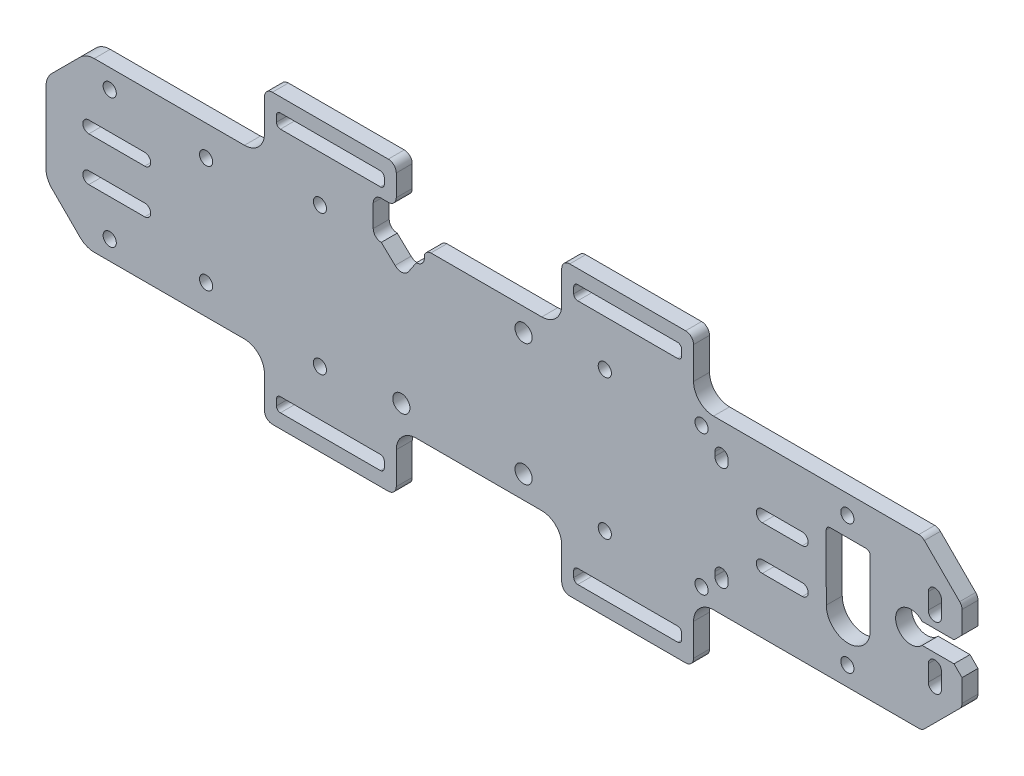
from build123d import *

# Parameters (mm, degrees)
SKETCH_1_R           = 1.65
EXTRUDE_1_DEPTH      = 4
EXTRUDE_3_DEPTH      = 4
SKETCH_31_R          = 2.15
SKETCH_31_R_2        = 1.65
CUT_EXTRUDE_13_DEPTH = 113.95479314
CUT_EXTRUDE_6_DEPTH  = 4
SKETCH_24_R          = 1.65
CUT_EXTRUDE_10_DEPTH = 4
EXTRUDE_4_DEPTH      = 4
XT90_R               = 1.6
CUT_EXTRUDE_12_DEPTH = 148.442447393
FILLET_1_R           = 5
CUT_EXTRUDE_14_DEPTH = 148.442447393
CUT_EXTRUDE_11_DEPTH = 148.442447393
CUT_EXTRUDE_15_DEPTH = 134.20388618
CUT_EXTRUDE_16_DEPTH = 134.20388618


with BuildPart() as part:
    # Эскиз1 → Бобышка-Вытянуть1 (new body)
    with BuildSketch(Plane.XY):
        Polygon((104, -28.895162528), (104, 13.104837472), (-88, 13.104837472), (-98, 3.104837472), (-98, -18.895162528), (-88, -28.895162528), align=None)
        with Locations((-87.65, -24.095162528)):
            Circle(SKETCH_1_R, mode=Mode.SUBTRACT)
        with Locations((-87.65, 8.304837472)):
            Circle(SKETCH_1_R, mode=Mode.SUBTRACT)
    extrude(amount=EXTRUDE_1_DEPTH)

    # Эскиз7 → Бобышка-Вытянуть3 (add)
    # profile 1 of 4: a face of its own
    with BuildSketch(Plane(origin=(0, 0, 0), x_dir=(-1, 0, 0), z_dir=(0, 0, -1))):
        with BuildLine():
            Line((-56.5, 28.104837472), (-27.5, 28.104837472))
            ThreePointArc((-27.5, 28.104837472), (-26.085786438, 27.519051034), (-25.5, 26.104837472))
            Line((-25.5, 26.104837472), (-25.5, 18.104837472))
            ThreePointArc((-25.5, 18.104837472), (-24.035533906, 14.569303566), (-20.5, 13.104837472))
            Line((-20.5, 13.104837472), (-25.5, 13.104837472))
            Line((-25.5, 13.104837472), (-58.5, 13.104837472))
            Line((-58.5, 13.104837472), (-63.5, 13.104837472))
            ThreePointArc((-63.5, 13.104837472), (-59.964466094, 14.569303566), (-58.5, 18.104837472))
            Line((-58.5, 18.104837472), (-58.5, 26.104837472))
            ThreePointArc((-58.5, 26.104837472), (-57.914213562, 27.519051034), (-56.5, 28.104837472))
        make_face()
        with BuildLine():
            Line((-54.5, 24.604837472), (-29.5, 24.604837472))
            ThreePointArc((-29.5, 24.604837472), (-28.792893219, 24.311944253), (-28.5, 23.604837472))
            Line((-28.5, 23.604837472), (-28.5, 22.104837472))
            ThreePointArc((-28.5, 22.104837472), (-28.792893219, 21.397730691), (-29.5, 21.104837472))
            Line((-29.5, 21.104837472), (-54.5, 21.104837472))
            ThreePointArc((-54.5, 21.104837472), (-55.207106781, 21.397730691), (-55.5, 22.104837472))
            Line((-55.5, 22.104837472), (-55.5, 23.604837472))
            ThreePointArc((-55.5, 23.604837472), (-55.207106781, 24.311944253), (-54.5, 24.604837472))
        make_face(mode=Mode.SUBTRACT)
    # profile 2 of 4: a face of its own
    with BuildSketch(Plane(origin=(0, 0, 0), x_dir=(-1, 0, 0), z_dir=(0, 0, -1))):
        with BuildLine():
            Line((-58.5, -41.895162528), (-58.5, -33.895162528))
            ThreePointArc((-58.5, -33.895162528), (-59.964466094, -30.359628622), (-63.5, -28.895162528))
            Line((-63.5, -28.895162528), (-58.5, -28.895162528))
            Line((-58.5, -28.895162528), (-25.5, -28.895162528))
            Line((-25.5, -28.895162528), (-20.5, -28.895162528))
            ThreePointArc((-20.5, -28.895162528), (-24.035533906, -30.359628622), (-25.5, -33.895162528))
            Line((-25.5, -33.895162528), (-25.5, -41.895162528))
            ThreePointArc((-25.5, -41.895162528), (-26.085786438, -43.30937609), (-27.5, -43.895162528))
            Line((-27.5, -43.895162528), (-56.5, -43.895162528))
            ThreePointArc((-56.5, -43.895162528), (-57.914213562, -43.30937609), (-58.5, -41.895162528))
        make_face()
        with BuildLine():
            Line((-54.5, -36.895162528), (-29.5, -36.895162528))
            ThreePointArc((-29.5, -36.895162528), (-28.792893219, -37.188055747), (-28.5, -37.895162528))
            Line((-28.5, -37.895162528), (-28.5, -39.395162528))
            ThreePointArc((-28.5, -39.395162528), (-28.792893219, -40.102269309), (-29.5, -40.395162528))
            Line((-29.5, -40.395162528), (-54.5, -40.395162528))
            ThreePointArc((-54.5, -40.395162528), (-55.207106781, -40.102269309), (-55.5, -39.395162528))
            Line((-55.5, -39.395162528), (-55.5, -37.895162528))
            ThreePointArc((-55.5, -37.895162528), (-55.207106781, -37.188055747), (-54.5, -36.895162528))
        make_face(mode=Mode.SUBTRACT)
    # profile 3 of 4: a face of its own
    with BuildSketch(Plane(origin=(0, 0, 0), x_dir=(-1, 0, 0), z_dir=(0, 0, -1))):
        with BuildLine():
            Line((15.92, 13.104837472), (10.92, 13.104837472))
            ThreePointArc((10.92, 13.104837472), (14.455533906, 14.569303566), (15.92, 18.104837472))
            Line((15.92, 18.104837472), (15.92, 26.104837472))
            ThreePointArc((15.92, 26.104837472), (16.505786438, 27.519051034), (17.92, 28.104837472))
            Line((17.92, 28.104837472), (46.92, 28.104837472))
            ThreePointArc((46.92, 28.104837472), (48.334213562, 27.519051034), (48.92, 26.104837472))
            Line((48.92, 26.104837472), (48.92, 18.104837472))
            ThreePointArc((48.92, 18.104837472), (50.384466094, 14.569303566), (53.92, 13.104837472))
            Line((53.92, 13.104837472), (48.92, 13.104837472))
            Line((48.92, 13.104837472), (15.92, 13.104837472))
        make_face()
        with BuildLine():
            Line((18.92, 23.604837472), (18.92, 22.104837472))
            ThreePointArc((18.92, 22.104837472), (19.212893219, 21.397730691), (19.92, 21.104837472))
            Line((19.92, 21.104837472), (44.92, 21.104837472))
            ThreePointArc((44.92, 21.104837472), (45.627106781, 21.397730691), (45.92, 22.104837472))
            Line((45.92, 22.104837472), (45.92, 23.604837472))
            ThreePointArc((45.92, 23.604837472), (45.627106781, 24.311944253), (44.92, 24.604837472))
            Line((44.92, 24.604837472), (19.92, 24.604837472))
            ThreePointArc((19.92, 24.604837472), (19.212893219, 24.311944253), (18.92, 23.604837472))
        make_face(mode=Mode.SUBTRACT)
    # profile 4 of 4: a face of its own
    with BuildSketch(Plane(origin=(0, 0, 0), x_dir=(-1, 0, 0), z_dir=(0, 0, -1))):
        with BuildLine():
            Line((53.92, -28.895162528), (48.92, -28.895162528))
            Line((48.92, -28.895162528), (15.92, -28.895162528))
            Line((15.92, -28.895162528), (10.92, -28.895162528))
            ThreePointArc((10.92, -28.895162528), (14.455533906, -30.359628622), (15.92, -33.895162528))
            Line((15.92, -33.895162528), (15.92, -41.895162528))
            ThreePointArc((15.92, -41.895162528), (16.505786438, -43.30937609), (17.92, -43.895162528))
            Line((17.92, -43.895162528), (46.92, -43.895162528))
            ThreePointArc((46.92, -43.895162528), (48.334213562, -43.30937609), (48.92, -41.895162528))
            Line((48.92, -41.895162528), (48.92, -33.895162528))
            ThreePointArc((48.92, -33.895162528), (50.384466094, -30.359628622), (53.92, -28.895162528))
        make_face()
        with BuildLine():
            Line((45.92, -39.395162528), (45.92, -37.895162528))
            ThreePointArc((45.92, -37.895162528), (45.627106781, -37.188055747), (44.92, -36.895162528))
            Line((44.92, -36.895162528), (19.92, -36.895162528))
            ThreePointArc((19.92, -36.895162528), (19.212893219, -37.188055747), (18.92, -37.895162528))
            Line((18.92, -37.895162528), (18.92, -39.395162528))
            ThreePointArc((18.92, -39.395162528), (19.212893219, -40.102269309), (19.92, -40.395162528))
            Line((19.92, -40.395162528), (44.92, -40.395162528))
            ThreePointArc((44.92, -40.395162528), (45.627106781, -40.102269309), (45.92, -39.395162528))
        make_face(mode=Mode.SUBTRACT)
    extrude(amount=-EXTRUDE_3_DEPTH)

    # Эскиз31 → Вырез-Вытянуть13 (cut, through all)
    with BuildSketch(Plane.XY.offset(4)):
        with Locations((-14.65, 7.404837472)):
            Circle(SKETCH_31_R)
        with Locations(Location((15.95, 7.404837472, 0), (0, 0, 180))):
            Circle(SKETCH_31_R)
        with Locations((15.95, -23.195162528)):
            Circle(SKETCH_31_R)
        with Locations(Location((-14.65, -23.195162528, 0), (0, 0, 180))):
            Circle(SKETCH_31_R)
        with Locations((97, 8.304837472)):
            Circle(SKETCH_31_R_2)
        with Locations((97, -24.095162528)):
            Circle(SKETCH_31_R_2)
        with Locations((36.283094907, 9.604837472)):
            Circle(SKETCH_31_R_2)
        with Locations((-35.033416577, -25.395162528)):
            Circle(SKETCH_31_R_2)
        with Locations((-35.033416577, 9.604837472)):
            Circle(SKETCH_31_R_2)
        with Locations((36.283094907, -25.395162528)):
            Circle(SKETCH_31_R_2)
    extrude(amount=-CUT_EXTRUDE_13_DEPTH, mode=Mode.SUBTRACT)

    # Эскиз16 → Вырез-Вытянуть6 (cut)
    with BuildSketch(Plane(origin=(0, 0, 0), x_dir=(-1, 0, 0), z_dir=(0, 0, -1))):
        with BuildLine():
            Line((-67.132510911, 5.534287472), (-67.132510911, 4.534287472))
            ThreePointArc((-67.132510911, 4.534287472), (-65.482510911, 2.884287472), (-63.832510911, 4.534287472))
            Line((-63.832510911, 4.534287472), (-63.832510911, 5.534287472))
            ThreePointArc((-63.832510911, 5.534287472), (-65.482510911, 7.184287472), (-67.132510911, 5.534287472))
        make_face()
        with BuildLine():
            Line((-67.132510911, -20.465712528), (-67.132510911, -21.465712528))
            ThreePointArc((-67.132510911, -21.465712528), (-65.482510911, -23.115712528), (-63.832510911, -21.465712528))
            Line((-63.832510911, -21.465712528), (-63.832510911, -20.465712528))
            ThreePointArc((-63.832510911, -20.465712528), (-65.482510911, -18.815712528), (-67.132510911, -20.465712528))
        make_face()
        with BuildLine():
            ThreePointArc((65.167489089, 5.534287472), (63.517489089, 7.184287472), (61.867489089, 5.534287472))
            ThreePointArc((61.867489089, 5.534287472), (63.517489089, 3.884287472), (65.167489089, 5.534287472))
        make_face()
        with BuildLine():
            ThreePointArc((65.167489089, -21.465712528), (63.517489089, -19.815712528), (61.867489089, -21.465712528))
            ThreePointArc((61.867489089, -21.465712528), (63.517489089, -23.115712528), (65.167489089, -21.465712528))
        make_face()
    extrude(amount=-CUT_EXTRUDE_6_DEPTH, mode=Mode.SUBTRACT)

    # Эскиз24 → Вырез-Вытянуть10 (cut)
    with BuildSketch(Plane.XY.offset(4)):
        with Locations((60.5, 9.604837472)):
            Circle(SKETCH_24_R)
        with Locations((60.5, -25.395162528)):
            Circle(SKETCH_24_R)
    extrude(amount=-CUT_EXTRUDE_10_DEPTH, mode=Mode.SUBTRACT)

    # Эскиз28 → Бобышка-Вытянуть4 (add)
    with BuildSketch(Plane(origin=(0, 0, 0), x_dir=(-1, 0, 0), z_dir=(0, 0, -1))):
        Polygon((-140.7, 3.104837472), (-140.7, -18.895162528), (-130.7, -28.895162528), (-104, -28.895162528), (-104, 13.104837472), (-130.7, 13.104837472), align=None)
        Polygon((88, -28.895162528), (98, -18.895162528), (98, 3.104837472), (88, 13.104837472), (93.6, 13.104837472), (103.6, 3.104837472), (103.6, -18.895162528), (93.6, -28.895162528), align=None)
    extrude(amount=-EXTRUDE_4_DEPTH)

    # xt90 → Вырез-Вытянуть12 (cut, through all)
    with BuildSketch(Plane.XY):
        with Locations((97, -24.095162528)):
            Circle(XT90_R)
        with Locations((97, 8.304837472)):
            Circle(XT90_R)
        with BuildLine():
            Line((102.710962083, -14.22310833), (102.710962083, 2.105402936))
            Line((102.710962083, 2.105402936), (102.710962083, 2.507313762))
            ThreePointArc((102.710962083, 2.507313762), (102.418068864, 3.214420543), (101.710962083, 3.507313762))
            Line((101.710962083, 3.507313762), (101.310391617, 3.507851425))
            Line((101.310391617, 3.507851425), (92.689608383, 3.51940328))
            ThreePointArc((92.689608383, 3.51940328), (91.991192664, 3.224752519), (91.700121935, 2.524837226))
            Line((91.700121935, 2.524837226), (91.717960698, -13.776804257))
            ThreePointArc((91.717960698, -13.776804257), (97, -19.282396005), (102.710962083, -14.22310833))
        make_face()
    extrude(amount=CUT_EXTRUDE_12_DEPTH, mode=Mode.SUBTRACT)

    # Скругление1
    fillet_1_edges = [part.edges().sort_by_distance(p)[0] for p in [
        (-93.6, -28.895162528, 2),
        (-103.6, -18.895162528, 2),
        (-103.6, 3.104837472, 2),
        (-93.6, 13.104837472, 2),
    ]]
    fillet(fillet_1_edges, radius=FILLET_1_R)

    # Эскиз34 → Вырез-Вытянуть14 (cut, through all)
    with BuildSketch(Plane(origin=(0, 0, 0), x_dir=(-1, 0, 0), z_dir=(0, 0, -1))):
        with BuildLine():
            Line((8.886371967, 11.936868629), (8.886371967, 11.147568324))
            ThreePointArc((8.886371967, 11.147568324), (9.476624414, 9.728902811), (10.898983803, 9.147608089))
            Line((10.898983803, 9.147608089), (12.862551489, 6.210045515))
            ThreePointArc((12.862551489, 6.210045515), (14.467398539, 5.26260576), (16.209445598, 5.924759965))
            Line((16.209445598, 5.924759965), (19.686722791, 9.173602548))
            ThreePointArc((19.686722791, 9.173602548), (21.100936353, 9.759388986), (21.686722791, 11.173602548))
            Line((21.686722791, 11.173602548), (21.686722791, 16.743602548))
            ThreePointArc((21.686722791, 16.743602548), (21.100936353, 18.157816111), (19.686722791, 18.743602548))
            Line((19.686722791, 18.743602548), (17.920179993, 18.743602548))
            ThreePointArc((17.920179993, 18.743602548), (16.50596643, 19.329388986), (15.920179993, 20.743602548))
            Line((15.920179993, 20.743602548), (6.886902783, 13.104837472))
            ThreePointArc((6.886902783, 13.104837472), (8.072860695, 12.83965247), (8.886371967, 11.936868629))
        make_face()
    extrude(amount=-CUT_EXTRUDE_14_DEPTH, mode=Mode.SUBTRACT)

    # Эскиз30 → Вырез-Вытянуть11 (cut, through all)
    with BuildSketch(Plane(origin=(0, 0, 0), x_dir=(-1, 0, 0), z_dir=(0, 0, -1))):
        with BuildLine():
            Line((-120.7, -10.495162528), (-118.9, -10.495162528))
            Line((-118.9, -10.495162528), (-115.70910977, -10.495162528))
            ThreePointArc((-115.70910977, -10.495162528), (-109.072324766, -7.895162528), (-115.70910977, -5.295162528))
            Line((-115.70910977, -5.295162528), (-118.9, -5.295162528))
            Line((-118.9, -5.295162528), (-120.7, -5.295162528))
            Line((-120.7, -5.295162528), (-123.7, -5.295162528))
            Line((-123.7, -5.295162528), (-125.7, -3.295162528))
            Line((-125.7, -3.295162528), (-125.7, -0.295162528))
            Line((-125.7, -0.295162528), (-125.7, 2.276410347))
            ThreePointArc((-125.7, 2.276410347), (-125.547759065, 3.041777212), (-125.114213562, 3.69062391))
            Line((-125.114213562, 3.69062391), (-116.285786438, 12.519051034))
            ThreePointArc((-116.285786438, 12.519051034), (-115.63693974, 12.952596537), (-114.871572875, 13.104837472))
            Line((-114.871572875, 13.104837472), (-130.7, 13.104837472))
            Line((-130.7, 13.104837472), (-140.7, 3.104837472))
            Line((-140.7, 3.104837472), (-140.7, -18.895162528))
            Line((-140.7, -18.895162528), (-130.7, -28.895162528))
            Line((-130.7, -28.895162528), (-114.871572875, -28.895162528))
            ThreePointArc((-114.871572875, -28.895162528), (-115.63693974, -28.742921593), (-116.285786438, -28.30937609))
            Line((-116.285786438, -28.30937609), (-125.114213562, -19.480948966))
            ThreePointArc((-125.114213562, -19.480948966), (-125.547759065, -18.832102268), (-125.7, -18.066735403))
            Line((-125.7, -18.066735403), (-125.7, -15.495162528))
            Line((-125.7, -15.495162528), (-125.7, -12.495162528))
            Line((-125.7, -12.495162528), (-123.7, -10.495162528))
            Line((-123.7, -10.495162528), (-120.7, -10.495162528))
        make_face()
        with BuildLine():
            Line((-120.55, 1.904837472), (-120.55, -2.095162528))
            ThreePointArc((-120.55, -2.095162528), (-118.9, -3.745162528), (-117.25, -2.095162528))
            Line((-117.25, -2.095162528), (-117.25, 1.904837472))
            ThreePointArc((-117.25, 1.904837472), (-118.9, 3.554837472), (-120.55, 1.904837472))
        make_face()
        with BuildLine():
            Line((-120.55, -17.695162528), (-120.55, -13.695162528))
            ThreePointArc((-120.55, -13.695162528), (-118.9, -12.045162528), (-117.25, -13.695162528))
            Line((-117.25, -13.695162528), (-117.25, -17.695162528))
            ThreePointArc((-117.25, -17.695162528), (-118.9, -19.345162528), (-120.55, -17.695162528))
        make_face()
    extrude(amount=-CUT_EXTRUDE_11_DEPTH, mode=Mode.SUBTRACT)

    # Эскиз35 → Вырез-Вытянуть15 (cut, through all)
    with BuildSketch(Plane(origin=(0, 0, 0), x_dir=(-1, 0, 0), z_dir=(0, 0, -1))):
        with BuildLine():
            Line((-85.7, -3.895162528), (-75.7, -3.895162528))
            ThreePointArc((-75.7, -3.895162528), (-74.2, -2.395162528), (-75.7, -0.895162528))
            Line((-75.7, -0.895162528), (-85.7, -0.895162528))
            ThreePointArc((-85.7, -0.895162528), (-87.2, -2.395162528), (-85.7, -3.895162528))
        make_face()
        with BuildLine():
            Line((-85.7, -14.895162528), (-75.7, -14.895162528))
            ThreePointArc((-75.7, -14.895162528), (-74.2, -13.395162528), (-75.7, -11.895162528))
            Line((-75.7, -11.895162528), (-85.7, -11.895162528))
            ThreePointArc((-85.7, -11.895162528), (-87.2, -13.395162528), (-85.7, -14.895162528))
        make_face()
    extrude(amount=-CUT_EXTRUDE_15_DEPTH, mode=Mode.SUBTRACT)

    # Эскиз36 → Вырез-Вытянуть16 (cut, through all)
    with BuildSketch(Plane(origin=(0, 0, 0), x_dir=(-1, 0, 0), z_dir=(0, 0, -1))):
        with BuildLine():
            Line((78.885, -0.895162528), (92.885, -0.895162528))
            ThreePointArc((92.885, -0.895162528), (94.385, -2.395162528), (92.885, -3.895162528))
            Line((92.885, -3.895162528), (78.885, -3.895162528))
            ThreePointArc((78.885, -3.895162528), (77.385, -2.395162528), (78.885, -0.895162528))
        make_face()
        with BuildLine():
            Line((78.885, -14.895162528), (92.885, -14.895162528))
            ThreePointArc((92.885, -14.895162528), (94.385, -13.395162528), (92.885, -11.895162528))
            Line((92.885, -11.895162528), (78.885, -11.895162528))
            ThreePointArc((78.885, -11.895162528), (77.385, -13.395162528), (78.885, -14.895162528))
        make_face()
    extrude(amount=-CUT_EXTRUDE_16_DEPTH, mode=Mode.SUBTRACT)


solid = part.part
